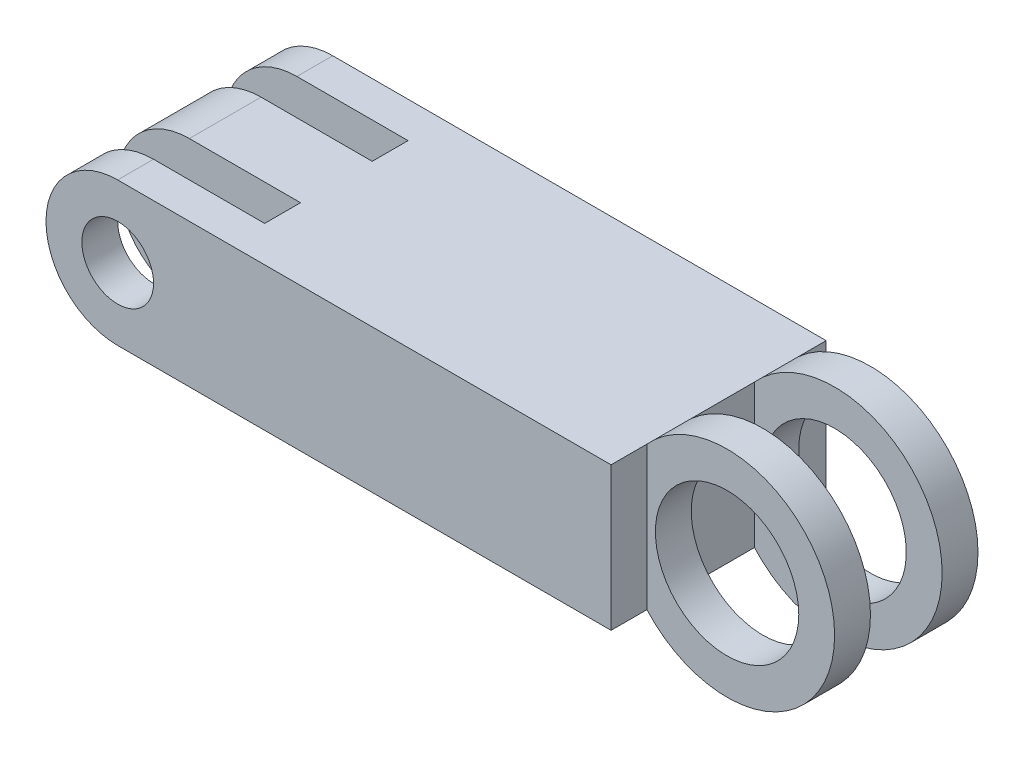
from build123d import *

# Parameters (mm, degrees)
BOSS_EXTRUDE1_DEPTH     = 38.1
CUT_EXTRUDE1_START      = 6.35
CUT_EXTRUDE1_DEPTH      = 6.35
CUT_EXTRUDE2_DEPTH      = 97.186429746
CUT_EXTRUDE2_DEPTH_BACK = 97.186429746
SKETCH3_R               = 6.35
BOSS_EXTRUDE2_START     = 6.35
SKETCH6_R               = 19.05
BOSS_EXTRUDE2_DEPTH     = 6.35
SKETCH7_R               = 12.7
CUT_EXTRUDE5_DEPTH      = 127.203753906


with BuildPart() as part:
    # Sketch1 → Boss-Extrude1 (new body)
    with BuildSketch(Plane.XY):
        with BuildLine():
            Line((0, 12.7), (87.400968343, 12.7))
            Line((87.400968343, 12.7), (87.400968343, -12.7))
            Line((87.400968343, -12.7), (0, -12.7))
            ThreePointArc((0, -12.7), (-12.7, 0), (0, 12.7))
        make_face()
    extrude(amount=BOSS_EXTRUDE1_DEPTH)

    # Sketch2 → Cut-Extrude1 (cut)
    with BuildSketch(Plane.XY.offset(CUT_EXTRUDE1_START)):
        with BuildLine():
            Line((0, -19.685), (19.685, -19.685))
            Line((19.685, -19.685), (19.685, 19.685))
            Line((19.685, 19.685), (0, 19.685))
            ThreePointArc((0, 19.685), (-19.685, 0), (0, -19.685))
        make_face()
    cut_extrude1 = extrude(amount=CUT_EXTRUDE1_DEPTH, mode=Mode.SUBTRACT)

    # Mirror1: Cut-Extrude1 across plane
    add(cut_extrude1.mirror(Plane(origin=(0, 0, 19.05), x_dir=(1, 0, 0), z_dir=(0, 0, -1))), mode=Mode.SUBTRACT)

    # Sketch3 → Cut-Extrude2 (cut, two sides: drawn at the far end of the back side and taken through both)
    with BuildSketch(Plane.XY.offset(38.1).offset(-CUT_EXTRUDE2_DEPTH_BACK)):
        Circle(SKETCH3_R)
    extrude(amount=CUT_EXTRUDE2_DEPTH + CUT_EXTRUDE2_DEPTH_BACK, mode=Mode.SUBTRACT)

    # Sketch6 → Boss-Extrude2 (add)
    with BuildSketch(Plane(origin=(0, 0, 19.05), x_dir=(-1, 0, 0), z_dir=(0, 0, -1)).offset(BOSS_EXTRUDE2_START)):
        with Locations((-101.6, 0)):
            Circle(SKETCH6_R)
    boss_extrude2 = extrude(amount=BOSS_EXTRUDE2_DEPTH)

    # Sketch7 → Cut-Extrude5 (cut, symmetric)
    with BuildSketch(Plane(origin=(0, 0, 6.35), x_dir=(-1, 0, 0), z_dir=(0, 0, -1))):
        with Locations((-101.6, 0)):
            Circle(SKETCH7_R)
    cut_extrude5 = extrude(amount=CUT_EXTRUDE5_DEPTH, both=True, mode=Mode.SUBTRACT)

    # Mirror3: Boss-Extrude2, Cut-Extrude5 across plane
    add(boss_extrude2.mirror(Plane(origin=(0, 0, 19.05), x_dir=(1, 0, 0), z_dir=(0, 0, -1))))
    add(cut_extrude5.mirror(Plane(origin=(0, 0, 19.05), x_dir=(1, 0, 0), z_dir=(0, 0, -1))), mode=Mode.SUBTRACT)


solid = part.part
